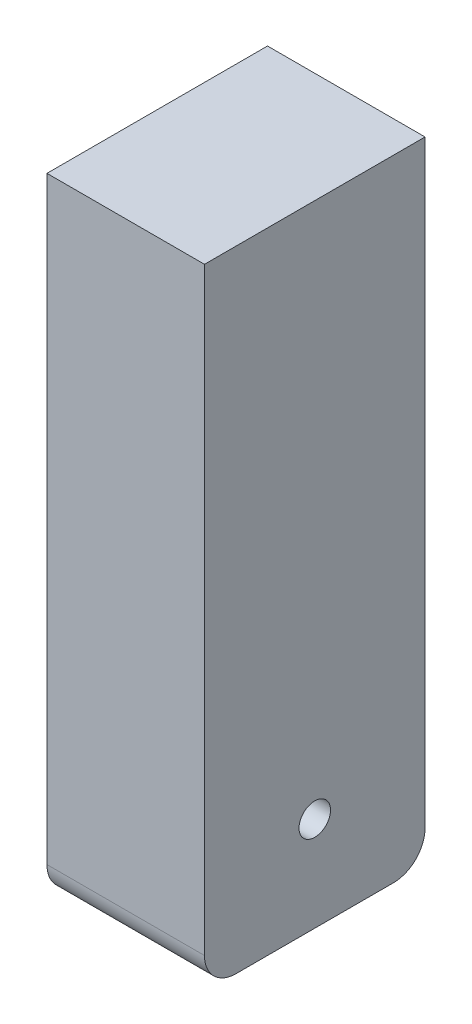
from build123d import *

# Parameters (mm, degrees)
SKETCH1_W           = 50
SKETCH1_H           = 70
BOSS_EXTRUDE1_DEPTH = 200
SKETCH2_R           = 5
CUT_EXTRUDE1_DEPTH  = 200
FILLET1_R           = 10


with BuildPart() as part:
    # Sketch1 → Boss-Extrude1 (new body)
    with BuildSketch(Plane(origin=(0, 0, 0), x_dir=(1, 0, 0), z_dir=(0, 1, 0))):
        Rectangle(SKETCH1_W, SKETCH1_H)
    extrude(amount=BOSS_EXTRUDE1_DEPTH)

    # Sketch2 → Cut-Extrude1 (cut)
    with BuildSketch(Plane.ZY.offset(25)):
        with Locations((0, 30)):
            Circle(SKETCH2_R)
    extrude(amount=-CUT_EXTRUDE1_DEPTH, mode=Mode.SUBTRACT)

    # Fillet1
    fillet1_edges = [part.edges().sort_by_distance(p)[0] for p in [
        (0, 0, 35),
        (0, 0, -35),
    ]]
    fillet(fillet1_edges, radius=FILLET1_R)


solid = part.part
